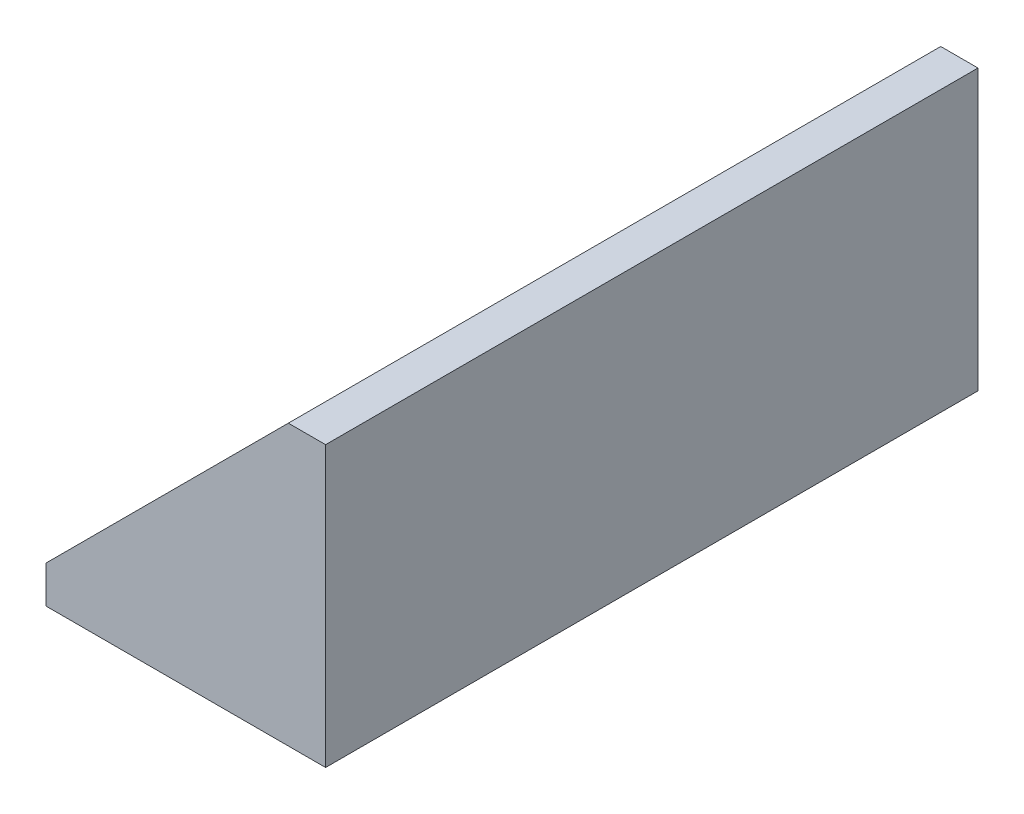
from build123d import *

# Parameters (mm, degrees)
BOSS_EXTRUDE1_DEPTH      = 70
BOSS_EXTRUDE2_DEPTH      = 4
BOSS_EXTRUDE3_DEPTH      = 4
BOSS_EXTRUDE4_DEPTH      = 2
BOSS_EXTRUDE4_DEPTH_BACK = 2


with BuildPart() as part:
    # Sketch1 → Boss-Extrude1 (new body)
    with BuildSketch(Plane.XY):
        Polygon((0, 0), (30, 0), (30, 30), (26, 30), (26, 4), (0, 4), align=None)
    extrude(amount=BOSS_EXTRUDE1_DEPTH)

    # Sketch2 → Boss-Extrude2 (add)
    with BuildSketch(Plane.XY.offset(70)):
        Polygon((26, 30), (0, 4), (26, 4), align=None)
    extrude(amount=-BOSS_EXTRUDE2_DEPTH)

    # Sketch3 → Boss-Extrude3 (add)
    with BuildSketch(Plane(origin=(0, 0, 0), x_dir=(-1, 0, 0), z_dir=(0, 0, -1))):
        Polygon((-26, 30), (0, 4), (-26, 4), align=None)
    extrude(amount=-BOSS_EXTRUDE3_DEPTH)

    # Sketch4 → Boss-Extrude4 (add, two sides: drawn at the far end of the back side and taken through both)
    with BuildSketch(Plane(origin=(0, 0, 35), x_dir=(-1, 0, 0), z_dir=(0, 0, -1)).offset(-BOSS_EXTRUDE4_DEPTH_BACK)):
        Polygon((-26, 30), (-26, 4), (0, 4), align=None)
    extrude(amount=BOSS_EXTRUDE4_DEPTH + BOSS_EXTRUDE4_DEPTH_BACK)


solid = part.part
